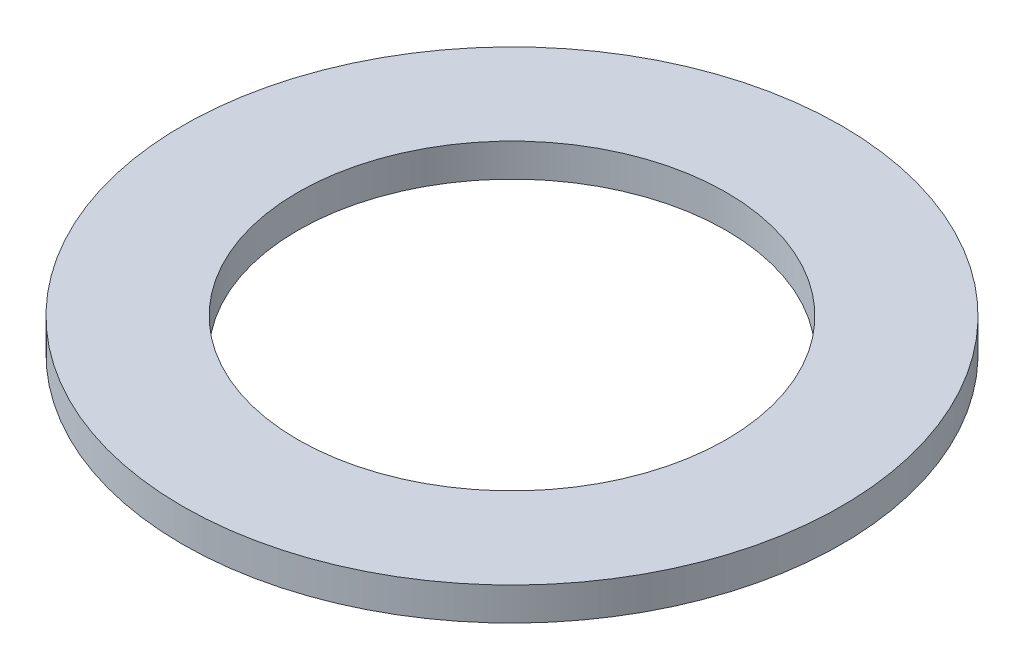
from build123d import *

# Parameters (mm, degrees)
IZIM2_R                     = 10
IZIM2_R_2                   = 6.5
Y_KSEKLIK_EKSTR_ZYON1_DEPTH = 1


with BuildPart() as part:
    # Çizim2 → Yükseklik-Ekstrüzyon1 (new body)
    with BuildSketch(Plane(origin=(0, 0, 0), x_dir=(1, 0, 0), z_dir=(0, 1, 0))):
        with Locations(Location((0, 0, 0), (0, 0, 270))):
            Circle(IZIM2_R)
        with Locations(Location((0, 0, 0), (0, 0, 270))):
            Circle(IZIM2_R_2, mode=Mode.SUBTRACT)
    extrude(amount=Y_KSEKLIK_EKSTR_ZYON1_DEPTH)


solid = part.part
